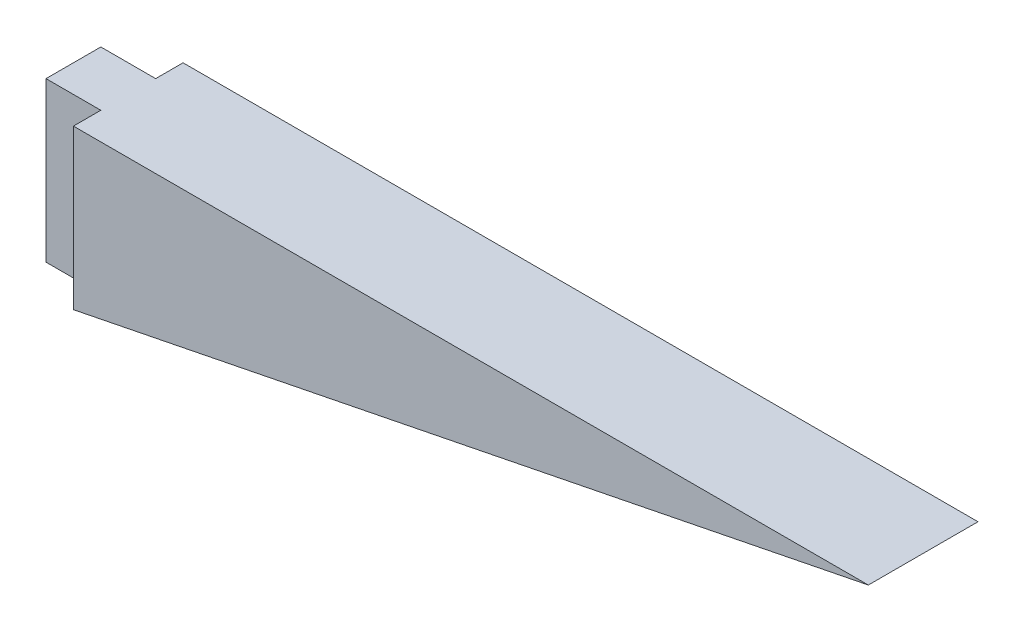
from build123d import *

# Parameters (mm, degrees)
SKETCH2_W           = 14.5
SKETCH2_H           = 2
BOSS_EXTRUDE1_DEPTH = 3
CUT_EXTRUDE2_DEPTH  = 10
SKETCH6_W           = 1
SKETCH6_H           = 2.899999999
BOSS_EXTRUDE3_DEPTH = 1


with BuildPart() as part:
    # Sketch2 → Boss-Extrude1 (new body)
    with BuildSketch(Plane(origin=(0, 0, 0), x_dir=(1, 0, 0), z_dir=(0, 1, 0))):
        with Locations((7.25, 1)):
            Rectangle(SKETCH2_W, SKETCH2_H)
    extrude(amount=BOSS_EXTRUDE1_DEPTH)

    # Sketch5 → Cut-Extrude2 (cut)
    with BuildSketch(Plane.XY):
        Polygon((14.5, 3), (-1.189290811, -0.137858161), (14.5, -0.137858161), align=None)
    extrude(amount=-CUT_EXTRUDE2_DEPTH, mode=Mode.SUBTRACT)

    # Sketch6 → Boss-Extrude3 (add)
    with BuildSketch(Plane.ZY):
        with Locations((-1, 1.550000001)):
            Rectangle(SKETCH6_W, SKETCH6_H)
    extrude(amount=BOSS_EXTRUDE3_DEPTH)


solid = part.part
